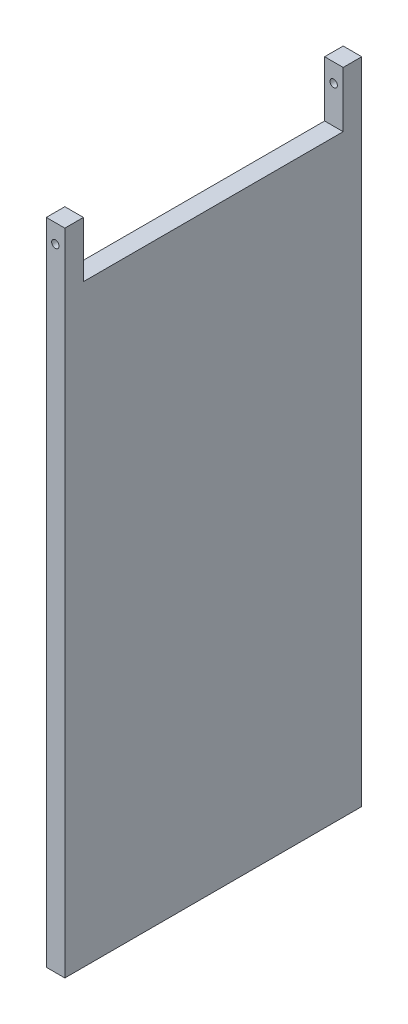
from build123d import *

# Parameters (mm, degrees)
ESQUISSE1_W             = 5
ESQUISSE1_H             = 175
ESQUISSE1_R             = 1
BOSS_EXTRU_1_DEPTH      = 80
ESQUISSE2_W             = 70
ESQUISSE2_H             = 15
ENL_V_MAT_EXTRU_1_DEPTH = 20


with BuildPart() as part:
    # Esquisse1 → Boss.-Extru.1 (new body)
    with BuildSketch(Plane.XY):
        with Locations((-4.901501369, 41.380516432)):
            Rectangle(ESQUISSE1_W, ESQUISSE1_H)
        with Locations((-4.956438342, 123.880516432)):
            Circle(ESQUISSE1_R, mode=Mode.SUBTRACT)
    extrude(amount=BOSS_EXTRU_1_DEPTH)

    # Esquisse2 → Enlèv. mat.-Extru.1 (cut)
    with BuildSketch(Plane(origin=(0, 0, 0), x_dir=(0, 0, -1), z_dir=(1, 0, 0))):
        with Locations((-40, 121.380516432)):
            Rectangle(ESQUISSE2_W, ESQUISSE2_H)
    extrude(amount=-ENL_V_MAT_EXTRU_1_DEPTH, mode=Mode.SUBTRACT)


solid = part.part
